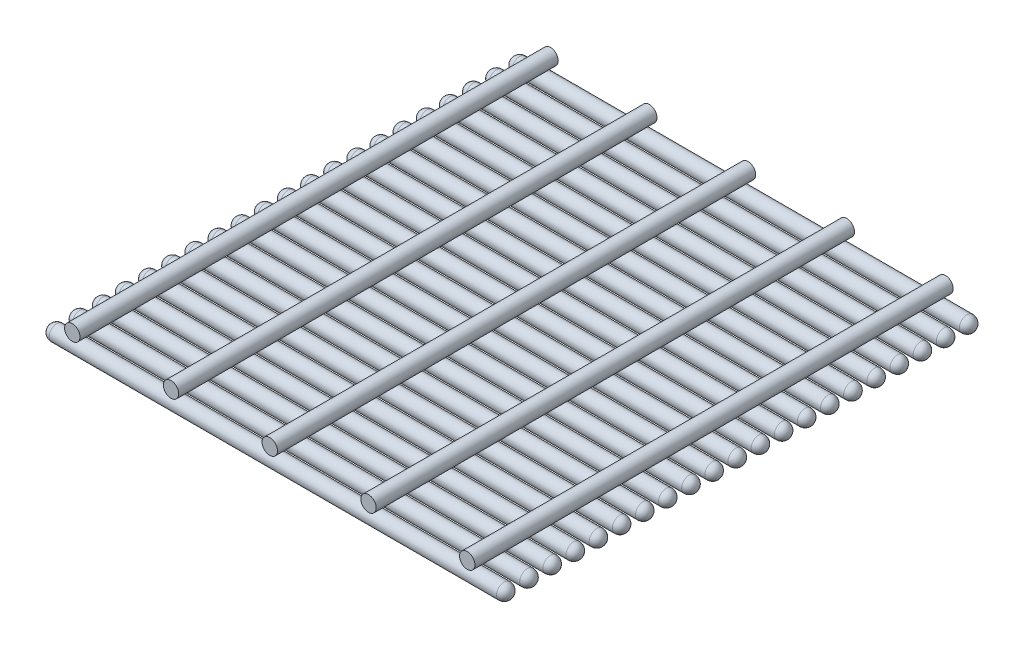
from build123d import *

# Parameters (mm, degrees)
ESQUISSE2_R                = 2.5
BOSS_EXTRU_1_DEPTH         = 150
CONG_4_R                   = 2.5
CONG_5_R                   = 2.5
R_P_TITION_LIN_AIRE2_COUNT = 21
R_P_TITION_LIN_AIRE2_PITCH = 7.5
BOSS_EXTRU_2_DEPTH         = 2.5
BOSS_EXTRU_2_DEPTH_BACK    = 152.5
ESQUISSE4_R                = 2.5
R_P_TITION_LIN_AIRE3_COUNT = 5
R_P_TITION_LIN_AIRE3_PITCH = 32


with BuildPart() as part:
    # Esquisse2 → Boss.-Extru.1 (new body)
    with BuildSketch(Plane(origin=(0, 0, 0), x_dir=(0, 0, -1), z_dir=(1, 0, 0))):
        Circle(ESQUISSE2_R)
    extrude(amount=BOSS_EXTRU_1_DEPTH)

    # Congé4
    cong_4_edges = [part.edges().sort_by_distance(p)[0] for p in [
        (0, 0, 2.5),
    ]]
    fillet(cong_4_edges, radius=CONG_4_R)

    # Congé5
    cong_5_edges = [part.edges().sort_by_distance(p)[0] for p in [
        (150, 0, 2.5),
    ]]
    fillet(cong_5_edges, radius=CONG_5_R)


with BuildPart() as r_p_tition_lin_aire2_1:
    # Répétition linéaire2: pattern copy
    add(part.part.moved(Location(Vector(0, 0, -1) * (1 * R_P_TITION_LIN_AIRE2_PITCH))))


with BuildPart() as r_p_tition_lin_aire2_2:
    # Répétition linéaire2: pattern copy
    add(part.part.moved(Location(Vector(0, 0, -1) * (2 * R_P_TITION_LIN_AIRE2_PITCH))))


with BuildPart() as r_p_tition_lin_aire2_3:
    # Répétition linéaire2: pattern copy
    add(part.part.moved(Location(Vector(0, 0, -1) * (3 * R_P_TITION_LIN_AIRE2_PITCH))))


with BuildPart() as r_p_tition_lin_aire2_4:
    # Répétition linéaire2: pattern copy
    add(part.part.moved(Location(Vector(0, 0, -1) * (4 * R_P_TITION_LIN_AIRE2_PITCH))))


with BuildPart() as r_p_tition_lin_aire2_5:
    # Répétition linéaire2: pattern copy
    add(part.part.moved(Location(Vector(0, 0, -1) * (5 * R_P_TITION_LIN_AIRE2_PITCH))))


with BuildPart() as r_p_tition_lin_aire2_6:
    # Répétition linéaire2: pattern copy
    add(part.part.moved(Location(Vector(0, 0, -1) * (6 * R_P_TITION_LIN_AIRE2_PITCH))))


with BuildPart() as r_p_tition_lin_aire2_7:
    # Répétition linéaire2: pattern copy
    add(part.part.moved(Location(Vector(0, 0, -1) * (7 * R_P_TITION_LIN_AIRE2_PITCH))))


with BuildPart() as r_p_tition_lin_aire2_8:
    # Répétition linéaire2: pattern copy
    add(part.part.moved(Location(Vector(0, 0, -1) * (8 * R_P_TITION_LIN_AIRE2_PITCH))))


with BuildPart() as r_p_tition_lin_aire2_9:
    # Répétition linéaire2: pattern copy
    add(part.part.moved(Location(Vector(0, 0, -1) * (9 * R_P_TITION_LIN_AIRE2_PITCH))))


with BuildPart() as r_p_tition_lin_aire2_10:
    # Répétition linéaire2: pattern copy
    add(part.part.moved(Location(Vector(0, 0, -1) * (10 * R_P_TITION_LIN_AIRE2_PITCH))))


with BuildPart() as r_p_tition_lin_aire2_11:
    # Répétition linéaire2: pattern copy
    add(part.part.moved(Location(Vector(0, 0, -1) * (11 * R_P_TITION_LIN_AIRE2_PITCH))))


with BuildPart() as r_p_tition_lin_aire2_12:
    # Répétition linéaire2: pattern copy
    add(part.part.moved(Location(Vector(0, 0, -1) * (12 * R_P_TITION_LIN_AIRE2_PITCH))))


with BuildPart() as r_p_tition_lin_aire2_13:
    # Répétition linéaire2: pattern copy
    add(part.part.moved(Location(Vector(0, 0, -1) * (13 * R_P_TITION_LIN_AIRE2_PITCH))))


with BuildPart() as r_p_tition_lin_aire2_14:
    # Répétition linéaire2: pattern copy
    add(part.part.moved(Location(Vector(0, 0, -1) * (14 * R_P_TITION_LIN_AIRE2_PITCH))))


with BuildPart() as r_p_tition_lin_aire2_15:
    # Répétition linéaire2: pattern copy
    add(part.part.moved(Location(Vector(0, 0, -1) * (15 * R_P_TITION_LIN_AIRE2_PITCH))))


with BuildPart() as r_p_tition_lin_aire2_16:
    # Répétition linéaire2: pattern copy
    add(part.part.moved(Location(Vector(0, 0, -1) * (16 * R_P_TITION_LIN_AIRE2_PITCH))))


with BuildPart() as r_p_tition_lin_aire2_17:
    # Répétition linéaire2: pattern copy
    add(part.part.moved(Location(Vector(0, 0, -1) * (17 * R_P_TITION_LIN_AIRE2_PITCH))))


with BuildPart() as r_p_tition_lin_aire2_18:
    # Répétition linéaire2: pattern copy
    add(part.part.moved(Location(Vector(0, 0, -1) * (18 * R_P_TITION_LIN_AIRE2_PITCH))))


with BuildPart() as r_p_tition_lin_aire2_19:
    # Répétition linéaire2: pattern copy
    add(part.part.moved(Location(Vector(0, 0, -1) * (19 * R_P_TITION_LIN_AIRE2_PITCH))))


with BuildPart() as r_p_tition_lin_aire2_20:
    # Répétition linéaire2: pattern copy
    add(part.part.moved(Location(Vector(0, 0, -1) * (20 * R_P_TITION_LIN_AIRE2_PITCH))))


with BuildPart() as body_22:
    # Esquisse4 → Boss.-Extru.2 (new, two sides: drawn at the far end of the back side and taken through both)
    with BuildSketch(Plane.XY.offset(-BOSS_EXTRU_2_DEPTH_BACK)):
        with Locations((10, 5)):
            Circle(ESQUISSE4_R)
    extrude(amount=BOSS_EXTRU_2_DEPTH + BOSS_EXTRU_2_DEPTH_BACK)


with BuildPart() as r_p_tition_lin_aire3_1:
    # Répétition linéaire3: pattern copy
    add(body_22.part.moved(Location(Vector(1, 0, 0) * (1 * R_P_TITION_LIN_AIRE3_PITCH))))


with BuildPart() as r_p_tition_lin_aire3_2:
    # Répétition linéaire3: pattern copy
    add(body_22.part.moved(Location(Vector(1, 0, 0) * (2 * R_P_TITION_LIN_AIRE3_PITCH))))


with BuildPart() as r_p_tition_lin_aire3_3:
    # Répétition linéaire3: pattern copy
    add(body_22.part.moved(Location(Vector(1, 0, 0) * (3 * R_P_TITION_LIN_AIRE3_PITCH))))


with BuildPart() as r_p_tition_lin_aire3_4:
    # Répétition linéaire3: pattern copy
    add(body_22.part.moved(Location(Vector(1, 0, 0) * (4 * R_P_TITION_LIN_AIRE3_PITCH))))


solid = Compound([part.part, r_p_tition_lin_aire2_1.part, r_p_tition_lin_aire2_2.part, r_p_tition_lin_aire2_3.part, r_p_tition_lin_aire2_4.part, r_p_tition_lin_aire2_5.part, r_p_tition_lin_aire2_6.part, r_p_tition_lin_aire2_7.part, r_p_tition_lin_aire2_8.part, r_p_tition_lin_aire2_9.part, r_p_tition_lin_aire2_10.part, r_p_tition_lin_aire2_11.part, r_p_tition_lin_aire2_12.part, r_p_tition_lin_aire2_13.part, r_p_tition_lin_aire2_14.part, r_p_tition_lin_aire2_15.part, r_p_tition_lin_aire2_16.part, r_p_tition_lin_aire2_17.part, r_p_tition_lin_aire2_18.part, r_p_tition_lin_aire2_19.part, r_p_tition_lin_aire2_20.part, body_22.part, r_p_tition_lin_aire3_1.part, r_p_tition_lin_aire3_2.part, r_p_tition_lin_aire3_3.part, r_p_tition_lin_aire3_4.part])
